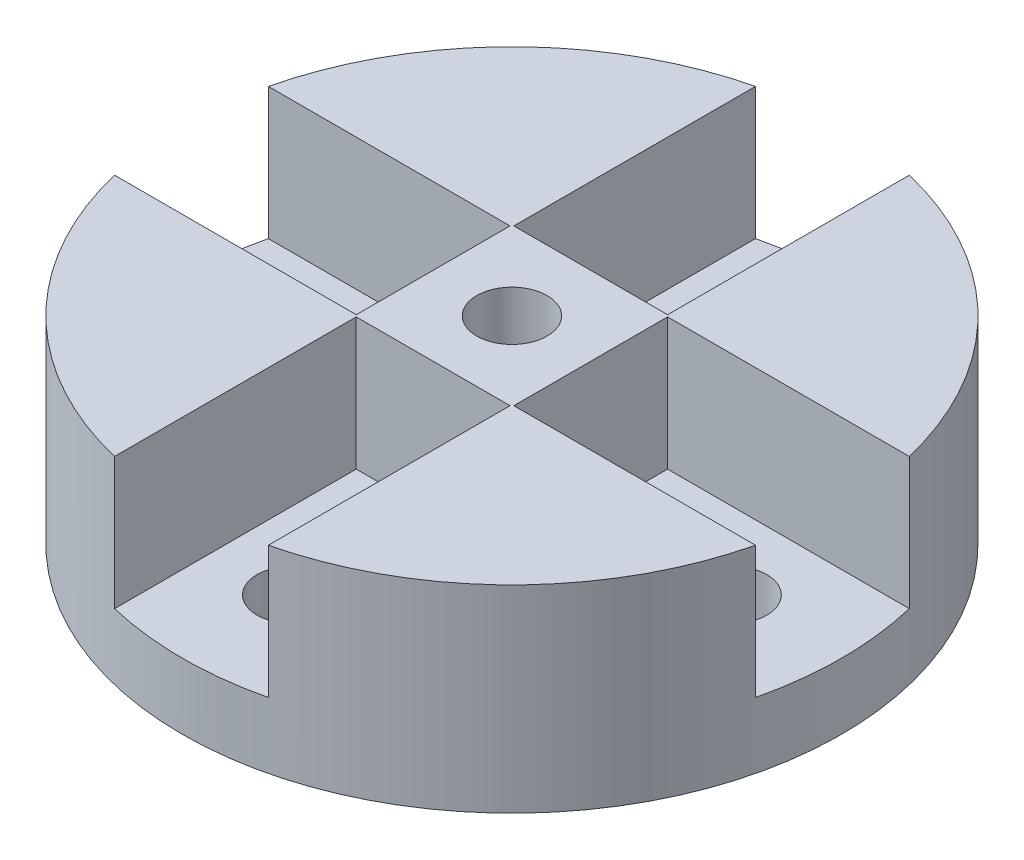
from build123d import *

# Parameters (mm, degrees)
SKETCH1_R           = 15
SKETCH1_R_2         = 1.6
BOSS_EXTRUDE1_DEPTH = 3
SKETCH2_R           = 1.6
BOSS_EXTRUDE2_DEPTH = 6


with BuildPart() as part:
    # Sketch1 → Boss-Extrude1 (new body)
    with BuildSketch(Plane(origin=(0, 0, 0), x_dir=(1, 0, 0), z_dir=(0, 1, 0))):
        Circle(SKETCH1_R)
        Circle(SKETCH1_R_2, mode=Mode.SUBTRACT)
        with Locations((0, 10)):
            Circle(SKETCH1_R_2, mode=Mode.SUBTRACT)
        with Locations((10, 0)):
            Circle(SKETCH1_R_2, mode=Mode.SUBTRACT)
        with Locations((0, -10)):
            Circle(SKETCH1_R_2, mode=Mode.SUBTRACT)
        with Locations((-10, 0)):
            Circle(SKETCH1_R_2, mode=Mode.SUBTRACT)
    extrude(amount=BOSS_EXTRUDE1_DEPTH)

    # Sketch2 → Boss-Extrude2 (add)
    with BuildSketch(Plane(origin=(0, 3, 0), x_dir=(1, 0, 0), z_dir=(0, 1, 0))):
        with BuildLine():
            Line((-3.585952146, -3.5), (-14.585952146, -3.5))
            ThreePointArc((-14.585952146, -3.5), (-10.606601718, -10.606601718), (-3.5, -14.585952146))
            Line((-3.5, -14.585952146), (-3.5, -3.585952146))
            Line((-3.5, -3.585952146), (3.5, -3.585952146))
            Line((3.5, -3.585952146), (3.5, -14.585952146))
            ThreePointArc((3.5, -14.585952146), (10.606601718, -10.606601718), (14.585952146, -3.5))
            Line((14.585952146, -3.5), (3.585952146, -3.5))
            Line((3.585952146, -3.5), (3.585952146, 3.5))
            Line((3.585952146, 3.5), (14.585952146, 3.5))
            ThreePointArc((14.585952146, 3.5), (10.606601718, 10.606601718), (3.5, 14.585952146))
            Line((3.5, 14.585952146), (3.5, 3.585952146))
            Line((3.5, 3.585952146), (-3.5, 3.585952146))
            Line((-3.5, 3.585952146), (-3.5, 14.585952146))
            ThreePointArc((-3.5, 14.585952146), (-10.606601718, 10.606601718), (-14.585952146, 3.5))
            Line((-14.585952146, 3.5), (-3.585952146, 3.5))
            Line((-3.585952146, 3.5), (-3.585952146, -3.5))
        make_face()
        Circle(SKETCH2_R, mode=Mode.SUBTRACT)
    extrude(amount=BOSS_EXTRUDE2_DEPTH)


solid = part.part
